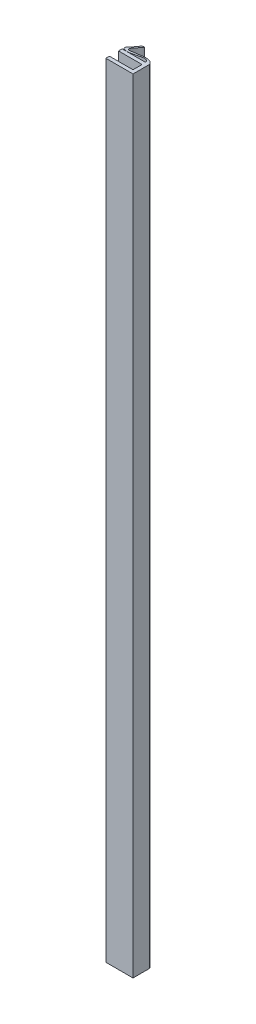
from build123d import *

# Parameters (mm, degrees)
SKETCH2_W           = 15
SKETCH2_H           = 432
BOSS_EXTRUDE1_DEPTH = 9
SKETCH3_W           = 5
SKETCH3_H           = 432
CUT_EXTRUDE1_DEPTH  = 13
BOSS_EXTRUDE2_DEPTH = 432


with BuildPart() as part:
    # Sketch2 → Boss-Extrude1 (new body)
    with BuildSketch(Plane.XY):
        with Locations((-130.833333333, -134.541666667)):
            Rectangle(SKETCH2_W, SKETCH2_H)
    extrude(amount=BOSS_EXTRUDE1_DEPTH)

    # Sketch3 → Cut-Extrude1 (cut)
    with BuildSketch(Plane.ZY.offset(138.333333333)):
        with Locations((4.5, -134.541666667)):
            Rectangle(SKETCH3_W, SKETCH3_H)
    extrude(amount=-CUT_EXTRUDE1_DEPTH, mode=Mode.SUBTRACT)

    # Sketch4 → Boss-Extrude2 (add)
    with BuildSketch(Plane(origin=(0, -350.541666667, 0), x_dir=(-1, 0, 0), z_dir=(0, -1, 0))):
        with BuildLine():
            Line((134.627901386, 5.826019791), (137.519705785, 2.650705157))
            add(Edge.make_bspline(
                [(137.519705785, 2.650705157), (139.065634243, 0.920144905), (135.489976746, -0.58045724), (131.42886231, 1.150786205), (125.569623368, 2.139804109), (125.536673176, 0)],
                knots=[0, 0, 0, 0, 0.203697922, 0.642664279, 1, 1, 1, 1], degree=3))
            Line((125.536673176, 0), (123.333333333, 0))
            add(Edge.make_bspline(
                [(123.333333333, 0), (125.020509015, 5.135082527), (139.792499923, -2.01631582), (135.120294759, 4.376293852), (131.838619773, 7.606418332), (135.233825794, 6.532568663), (134.627901386, 5.826019791)],
                knots=[0, 0, 0, 0, 0.624715385, 0.825429551, 0.90576283, 1, 1, 1, 1], degree=3))
        make_face()
    extrude(amount=-BOSS_EXTRUDE2_DEPTH)


solid = part.part
